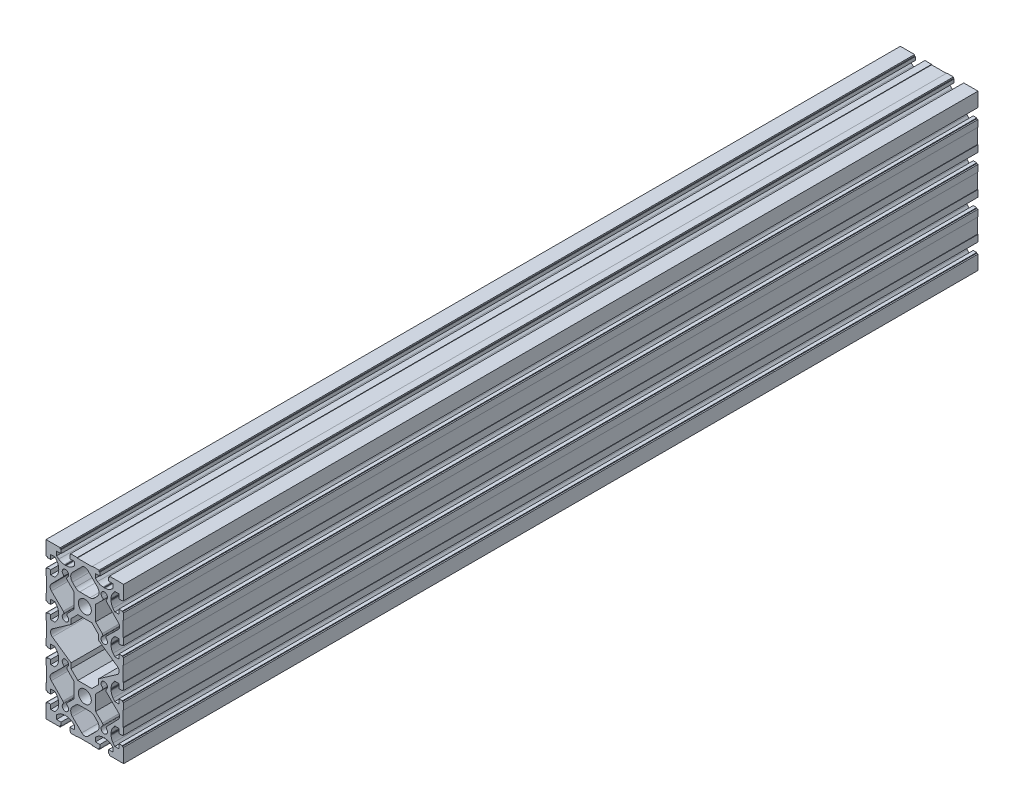
from build123d import *

# Parameters (mm, degrees)
SKETCH5_R           = 7.5
BOSS_EXTRUDE1_DEPTH = 990


with BuildPart() as part:
    # Sketch5 → Boss-Extrude1 (new body)
    with BuildSketch(Plane.XY.offset(10)):
        with BuildLine():
            Line((-45, 36.25), (-45, 28.5))
            Line((-45, 28.5), (-43.5, 28.5))
            Line((-43.5, 28.5), (-43.5, 27.6))
            Line((-43.5, 27.6), (-39.5, 27.6))
            Line((-39.5, 27.6), (-39.5, 32.75))
            Line((-39.5, 32.75), (-34.729898987, 32.75))
            Line((-34.729898987, 32.75), (-32.712991588, 30.246686356))
            ThreePointArc((-32.712991588, 30.246686356), (-31.06946226, 27.299135414), (-30.5, 23.972732261))
            Line((-30.5, 23.972732261), (-30.5, 23))
            Line((-30.5, 23), (-30, 22.5))
            Line((-30, 22.5), (-30.5, 22))
            Line((-30.5, 22), (-30.5, 21.027267739))
            ThreePointArc((-30.5, 21.027267739), (-31.06946226, 17.700864586), (-32.712991588, 14.753313644))
            Line((-32.712991588, 14.753313644), (-34.729898987, 12.25))
            Line((-34.729898987, 12.25), (-39.5, 12.25))
            Line((-39.5, 12.25), (-39.5, 17.4))
            Line((-39.5, 17.4), (-43.5, 17.4))
            Line((-43.5, 17.4), (-43.5, 16.5))
            Line((-43.5, 16.5), (-45, 16.5))
            Line((-45, 16.5), (-45, 8.75))
            Line((-45, 8.75), (-44.5, 8.75))
            Line((-44.5, 8.75), (-44.5, -8.75))
            Line((-44.5, -8.75), (-45, -8.75))
            Line((-45, -8.75), (-45, -16.5))
            Line((-45, -16.5), (-43.5, -16.5))
            Line((-43.5, -16.5), (-43.5, -17.4))
            Line((-43.5, -17.4), (-39.5, -17.4))
            Line((-39.5, -17.4), (-39.5, -12.25))
            Line((-39.5, -12.25), (-34.729898987, -12.25))
            Line((-34.729898987, -12.25), (-32.712991588, -14.753313644))
            ThreePointArc((-32.712991588, -14.753313644), (-31.06946226, -17.700864586), (-30.5, -21.027267739))
            Line((-30.5, -21.027267739), (-30.5, -22))
            Line((-30.5, -22), (-30, -22.5))
            Line((-30, -22.5), (-30.5, -23))
            Line((-30.5, -23), (-30.5, -23.972732261))
            ThreePointArc((-30.5, -23.972732261), (-31.06946226, -27.299135414), (-32.712991588, -30.246686356))
            Line((-32.712991588, -30.246686356), (-34.729898987, -32.75))
            Line((-34.729898987, -32.75), (-39.5, -32.75))
            Line((-39.5, -32.75), (-39.5, -27.6))
            Line((-39.5, -27.6), (-43.5, -27.6))
            Line((-43.5, -27.6), (-43.5, -28.5))
            Line((-43.5, -28.5), (-45, -28.5))
            Line((-45, -28.5), (-45, -36.25))
            Line((-45, -36.25), (-44.5, -36.25))
            Line((-44.5, -36.25), (-44.5, -53.75))
            Line((-44.5, -53.75), (-45, -53.75))
            Line((-45, -53.75), (-45, -61.5))
            Line((-45, -61.5), (-43.5, -61.5))
            Line((-43.5, -61.5), (-43.5, -62.4))
            Line((-43.5, -62.4), (-39.5, -62.4))
            Line((-39.5, -62.4), (-39.5, -57.25))
            Line((-39.5, -57.25), (-34.729898987, -57.25))
            Line((-34.729898987, -57.25), (-32.712991588, -59.753313644))
            ThreePointArc((-32.712991588, -59.753313644), (-31.06946226, -62.700864586), (-30.5, -66.027267739))
            Line((-30.5, -66.027267739), (-30.5, -67))
            Line((-30.5, -67), (-30, -67.5))
            Line((-30, -67.5), (-30.5, -68))
            Line((-30.5, -68), (-30.5, -68.972732261))
            ThreePointArc((-30.5, -68.972732261), (-31.06946226, -72.299135414), (-32.712991588, -75.246686356))
            Line((-32.712991588, -75.246686356), (-34.729898987, -77.75))
            Line((-34.729898987, -77.75), (-39.5, -77.75))
            Line((-39.5, -77.75), (-39.5, -72.6))
            Line((-39.5, -72.6), (-43.5, -72.6))
            Line((-43.5, -72.6), (-43.5, -73.5))
            Line((-43.5, -73.5), (-45, -73.5))
            Line((-45, -73.5), (-45, -90))
            Line((-45, -90), (-28.5, -90))
            Line((-28.5, -90), (-28.5, -88.5))
            Line((-28.5, -88.5), (-27.6, -88.5))
            Line((-27.6, -88.5), (-27.6, -84.5))
            Line((-27.6, -84.5), (-32.75, -84.5))
            Line((-32.75, -84.5), (-32.75, -79.729898987))
            Line((-32.75, -79.729898987), (-30.246686356, -77.712991588))
            ThreePointArc((-30.246686356, -77.712991588), (-27.299135414, -76.06946226), (-23.972732261, -75.5))
            Line((-23.972732261, -75.5), (-23, -75.5))
            Line((-23, -75.5), (-22.5, -75))
            Line((-22.5, -75), (-22, -75.5))
            Line((-22, -75.5), (-21.027267739, -75.5))
            ThreePointArc((-21.027267739, -75.5), (-17.700864586, -76.06946226), (-14.753313644, -77.712991588))
            Line((-14.753313644, -77.712991588), (-12.25, -79.729898987))
            Line((-12.25, -79.729898987), (-12.25, -84.5))
            Line((-12.25, -84.5), (-17.4, -84.5))
            Line((-17.4, -84.5), (-17.4, -88.5))
            Line((-17.4, -88.5), (-16.5, -88.5))
            Line((-16.5, -88.5), (-16.5, -90))
            Line((-16.5, -90), (-8.75, -90))
            Line((-8.75, -90), (-8.75, -89.5))
            Line((-8.75, -89.5), (8.75, -89.5))
            Line((8.75, -89.5), (8.75, -90))
            Line((8.75, -90), (16.5, -90))
            Line((16.5, -90), (16.5, -88.5))
            Line((16.5, -88.5), (17.4, -88.5))
            Line((17.4, -88.5), (17.4, -84.5))
            Line((17.4, -84.5), (12.25, -84.5))
            Line((12.25, -84.5), (12.25, -79.729898987))
            Line((12.25, -79.729898987), (14.753313644, -77.712991588))
            ThreePointArc((14.753313644, -77.712991588), (17.700864586, -76.06946226), (21.027267739, -75.5))
            Line((21.027267739, -75.5), (22, -75.5))
            Line((22, -75.5), (22.5, -75))
            Line((22.5, -75), (23, -75.5))
            Line((23, -75.5), (23.972732261, -75.5))
            ThreePointArc((23.972732261, -75.5), (27.299135414, -76.06946226), (30.246686356, -77.712991588))
            Line((30.246686356, -77.712991588), (32.75, -79.729898987))
            Line((32.75, -79.729898987), (32.75, -84.5))
            Line((32.75, -84.5), (27.6, -84.5))
            Line((27.6, -84.5), (27.6, -88.5))
            Line((27.6, -88.5), (28.5, -88.5))
            Line((28.5, -88.5), (28.5, -90))
            Line((28.5, -90), (45, -90))
            Line((45, -90), (45, -73.5))
            Line((45, -73.5), (43.5, -73.5))
            Line((43.5, -73.5), (43.5, -72.6))
            Line((43.5, -72.6), (39.5, -72.6))
            Line((39.5, -72.6), (39.5, -77.75))
            Line((39.5, -77.75), (34.729898987, -77.75))
            Line((34.729898987, -77.75), (32.712991588, -75.246686356))
            ThreePointArc((32.712991588, -75.246686356), (31.06946226, -72.299135414), (30.5, -68.972732261))
            Line((30.5, -68.972732261), (30.5, -68))
            Line((30.5, -68), (30, -67.5))
            Line((30, -67.5), (30.5, -67))
            Line((30.5, -67), (30.5, -66.027267739))
            ThreePointArc((30.5, -66.027267739), (31.06946226, -62.700864586), (32.712991588, -59.753313644))
            Line((32.712991588, -59.753313644), (34.729898987, -57.25))
            Line((34.729898987, -57.25), (39.5, -57.25))
            Line((39.5, -57.25), (39.5, -62.4))
            Line((39.5, -62.4), (43.5, -62.4))
            Line((43.5, -62.4), (43.5, -61.5))
            Line((43.5, -61.5), (45, -61.5))
            Line((45, -61.5), (45, -53.75))
            Line((45, -53.75), (44.5, -53.75))
            Line((44.5, -53.75), (44.5, -36.25))
            Line((44.5, -36.25), (45, -36.25))
            Line((45, -36.25), (45, -28.5))
            Line((45, -28.5), (43.5, -28.5))
            Line((43.5, -28.5), (43.5, -27.6))
            Line((43.5, -27.6), (39.5, -27.6))
            Line((39.5, -27.6), (39.5, -32.75))
            Line((39.5, -32.75), (34.729898987, -32.75))
            Line((34.729898987, -32.75), (32.712991588, -30.246686356))
            ThreePointArc((32.712991588, -30.246686356), (31.06946226, -27.299135414), (30.5, -23.972732261))
            Line((30.5, -23.972732261), (30.5, -23))
            Line((30.5, -23), (30, -22.5))
            Line((30, -22.5), (30.5, -22))
            Line((30.5, -22), (30.5, -21.027267739))
            ThreePointArc((30.5, -21.027267739), (31.06946226, -17.700864586), (32.712991588, -14.753313644))
            Line((32.712991588, -14.753313644), (34.729898987, -12.25))
            Line((34.729898987, -12.25), (39.5, -12.25))
            Line((39.5, -12.25), (39.5, -17.4))
            Line((39.5, -17.4), (43.5, -17.4))
            Line((43.5, -17.4), (43.5, -16.5))
            Line((43.5, -16.5), (45, -16.5))
            Line((45, -16.5), (45, -8.75))
            Line((45, -8.75), (44.5, -8.75))
            Line((44.5, -8.75), (44.5, 8.75))
            Line((44.5, 8.75), (45, 8.75))
            Line((45, 8.75), (45, 16.5))
            Line((45, 16.5), (43.5, 16.5))
            Line((43.5, 16.5), (43.5, 17.4))
            Line((43.5, 17.4), (39.5, 17.4))
            Line((39.5, 17.4), (39.5, 12.25))
            Line((39.5, 12.25), (34.729898987, 12.25))
            Line((34.729898987, 12.25), (32.712991588, 14.753313644))
            ThreePointArc((32.712991588, 14.753313644), (31.06946226, 17.700864586), (30.5, 21.027267739))
            Line((30.5, 21.027267739), (30.5, 22))
            Line((30.5, 22), (30, 22.5))
            Line((30, 22.5), (30.5, 23))
            Line((30.5, 23), (30.5, 23.972732261))
            ThreePointArc((30.5, 23.972732261), (31.06946226, 27.299135414), (32.712991588, 30.246686356))
            Line((32.712991588, 30.246686356), (34.729898987, 32.75))
            Line((34.729898987, 32.75), (39.5, 32.75))
            Line((39.5, 32.75), (39.5, 27.6))
            Line((39.5, 27.6), (43.5, 27.6))
            Line((43.5, 27.6), (43.5, 28.5))
            Line((43.5, 28.5), (45, 28.5))
            Line((45, 28.5), (45, 36.25))
            Line((45, 36.25), (44.5, 36.25))
            Line((44.5, 36.25), (44.5, 53.75))
            Line((44.5, 53.75), (45, 53.75))
            Line((45, 53.75), (45, 61.5))
            Line((45, 61.5), (43.5, 61.5))
            Line((43.5, 61.5), (43.5, 62.4))
            Line((43.5, 62.4), (39.5, 62.4))
            Line((39.5, 62.4), (39.5, 57.25))
            Line((39.5, 57.25), (34.729898987, 57.25))
            Line((34.729898987, 57.25), (32.712991588, 59.753313644))
            ThreePointArc((32.712991588, 59.753313644), (31.06946226, 62.700864586), (30.5, 66.027267739))
            Line((30.5, 66.027267739), (30.5, 67))
            Line((30.5, 67), (30, 67.5))
            Line((30, 67.5), (30.5, 68))
            Line((30.5, 68), (30.5, 68.972732261))
            ThreePointArc((30.5, 68.972732261), (31.06946226, 72.299135414), (32.712991588, 75.246686356))
            Line((32.712991588, 75.246686356), (34.729898987, 77.75))
            Line((34.729898987, 77.75), (39.5, 77.75))
            Line((39.5, 77.75), (39.5, 72.6))
            Line((39.5, 72.6), (43.5, 72.6))
            Line((43.5, 72.6), (43.5, 73.5))
            Line((43.5, 73.5), (45, 73.5))
            Line((45, 73.5), (45, 90))
            Line((45, 90), (28.5, 90))
            Line((28.5, 90), (28.5, 88.5))
            Line((28.5, 88.5), (27.6, 88.5))
            Line((27.6, 88.5), (27.6, 84.5))
            Line((27.6, 84.5), (32.75, 84.5))
            Line((32.75, 84.5), (32.75, 79.729898987))
            Line((32.75, 79.729898987), (30.246686356, 77.712991588))
            ThreePointArc((30.246686356, 77.712991588), (27.299135414, 76.06946226), (23.972732261, 75.5))
            Line((23.972732261, 75.5), (23, 75.5))
            Line((23, 75.5), (22.5, 75))
            Line((22.5, 75), (22, 75.5))
            Line((22, 75.5), (21.027267739, 75.5))
            ThreePointArc((21.027267739, 75.5), (17.700864586, 76.06946226), (14.753313644, 77.712991588))
            Line((14.753313644, 77.712991588), (12.25, 79.729898987))
            Line((12.25, 79.729898987), (12.25, 84.5))
            Line((12.25, 84.5), (17.4, 84.5))
            Line((17.4, 84.5), (17.4, 88.5))
            Line((17.4, 88.5), (16.5, 88.5))
            Line((16.5, 88.5), (16.5, 90))
            Line((16.5, 90), (8.75, 90))
            Line((8.75, 90), (8.75, 89.5))
            Line((8.75, 89.5), (-8.75, 89.5))
            Line((-8.75, 89.5), (-8.75, 90))
            Line((-8.75, 90), (-16.5, 90))
            Line((-16.5, 90), (-16.5, 88.5))
            Line((-16.5, 88.5), (-17.4, 88.5))
            Line((-17.4, 88.5), (-17.4, 84.5))
            Line((-17.4, 84.5), (-12.25, 84.5))
            Line((-12.25, 84.5), (-12.25, 79.729898987))
            Line((-12.25, 79.729898987), (-14.753313644, 77.712991588))
            ThreePointArc((-14.753313644, 77.712991588), (-17.700864586, 76.06946226), (-21.027267739, 75.5))
            Line((-21.027267739, 75.5), (-22, 75.5))
            Line((-22, 75.5), (-22.5, 75))
            Line((-22.5, 75), (-23, 75.5))
            Line((-23, 75.5), (-23.972732261, 75.5))
            ThreePointArc((-23.972732261, 75.5), (-27.299135414, 76.06946226), (-30.246686356, 77.712991588))
            Line((-30.246686356, 77.712991588), (-32.75, 79.729898987))
            Line((-32.75, 79.729898987), (-32.75, 84.5))
            Line((-32.75, 84.5), (-27.6, 84.5))
            Line((-27.6, 84.5), (-27.6, 88.5))
            Line((-27.6, 88.5), (-28.5, 88.5))
            Line((-28.5, 88.5), (-28.5, 90))
            Line((-28.5, 90), (-45, 90))
            Line((-45, 90), (-45, 73.5))
            Line((-45, 73.5), (-43.5, 73.5))
            Line((-43.5, 73.5), (-43.5, 72.6))
            Line((-43.5, 72.6), (-39.5, 72.6))
            Line((-39.5, 72.6), (-39.5, 77.75))
            Line((-39.5, 77.75), (-34.729898987, 77.75))
            Line((-34.729898987, 77.75), (-32.712991588, 75.246686356))
            ThreePointArc((-32.712991588, 75.246686356), (-31.06946226, 72.299135414), (-30.5, 68.972732261))
            Line((-30.5, 68.972732261), (-30.5, 68))
            Line((-30.5, 68), (-30, 67.5))
            Line((-30, 67.5), (-30.5, 67))
            Line((-30.5, 67), (-30.5, 66.027267739))
            ThreePointArc((-30.5, 66.027267739), (-31.06946226, 62.700864586), (-32.712991588, 59.753313644))
            Line((-32.712991588, 59.753313644), (-34.729898987, 57.25))
            Line((-34.729898987, 57.25), (-39.5, 57.25))
            Line((-39.5, 57.25), (-39.5, 62.4))
            Line((-39.5, 62.4), (-43.5, 62.4))
            Line((-43.5, 62.4), (-43.5, 61.5))
            Line((-43.5, 61.5), (-45, 61.5))
            Line((-45, 61.5), (-45, 53.75))
            Line((-45, 53.75), (-44.5, 53.75))
            Line((-44.5, 53.75), (-44.5, 36.25))
            Line((-44.5, 36.25), (-45, 36.25))
        make_face()
        with Locations((0, 45.086880858)):
            Circle(SKETCH5_R, mode=Mode.SUBTRACT)
        with Locations((0, -45.086880858)):
            Circle(SKETCH5_R, mode=Mode.SUBTRACT)
        with BuildLine():
            Line((-14.35107998, 62.566463458), (-10.85982128, 59.063435043))
            ThreePointArc((-10.85982128, 59.063435043), (-8.589599626, 57.542373557), (-5.909652822, 57.008126862))
            Line((-5.909652822, 57.008126862), (5.909652822, 57.008126862))
            ThreePointArc((5.909652822, 57.008126862), (8.589599626, 57.542373557), (10.85982128, 59.063435043))
            Line((10.85982128, 59.063435043), (14.35107998, 62.566463458))
            ThreePointArc((14.35107998, 62.566463458), (16.389756246, 67.5), (14.35107998, 72.433536542))
            Line((14.35107998, 72.433536542), (3.541478351, 83.279579449))
            ThreePointArc((3.541478351, 83.279579449), (0, 84.75), (-3.541478351, 83.279579449))
            Line((-3.541478351, 83.279579449), (-14.35107998, 72.433536542))
            ThreePointArc((-14.35107998, 72.433536542), (-16.389756246, 67.5), (-14.35107998, 62.566463458))
        make_face(mode=Mode.SUBTRACT)
        with BuildLine():
            Line((5.909652822, -57.008126862), (-5.909652822, -57.008126862))
            ThreePointArc((-5.909652822, -57.008126862), (-8.589599626, -57.542373557), (-10.85982128, -59.063435043))
            Line((-10.85982128, -59.063435043), (-14.35107998, -62.566463458))
            ThreePointArc((-14.35107998, -62.566463458), (-16.389756246, -67.5), (-14.35107998, -72.433536542))
            Line((-14.35107998, -72.433536542), (-3.541478351, -83.279579449))
            ThreePointArc((-3.541478351, -83.279579449), (0, -84.75), (3.541478351, -83.279579449))
            Line((3.541478351, -83.279579449), (14.35107998, -72.433536542))
            ThreePointArc((14.35107998, -72.433536542), (16.389756246, -67.5), (14.35107998, -62.566463458))
            Line((14.35107998, -62.566463458), (10.85982128, -59.063435043))
            ThreePointArc((10.85982128, -59.063435043), (8.589599626, -57.542373557), (5.909652822, -57.008126862))
        make_face(mode=Mode.SUBTRACT)
        with BuildLine():
            Line((-16, -25.11), (-8.11, -33))
            Line((-8.11, -33), (8.11, -33))
            Line((8.11, -33), (16, -25.11))
            Line((16, -25.11), (16, -19.23))
            Line((16, -19.23), (37.611740325, -4.095610054))
            ThreePointArc((37.611740325, -4.095610054), (39.743643694, 0), (37.611740325, 4.095610054))
            Line((37.611740325, 4.095610054), (16, 19.23))
            Line((16, 19.23), (16, 25.11))
            Line((16, 25.11), (8.11, 33))
            Line((8.11, 33), (-8.11, 33))
            Line((-8.11, 33), (-16, 25.11))
            Line((-16, 25.11), (-16, 19.23))
            Line((-16, 19.23), (-37.611740325, 4.095610054))
            ThreePointArc((-37.611740325, 4.095610054), (-39.743643694, 0), (-37.611740325, -4.095610054))
            Line((-37.611740325, -4.095610054), (-16, -19.23))
            Line((-16, -19.23), (-16, -25.11))
        make_face(mode=Mode.SUBTRACT)
        with BuildLine():
            Line((38.816173405, 48.578707453), (25.368550039, 62.360923911))
            ThreePointArc((25.368550039, 62.360923911), (24.800843667, 63.700716577), (25.291375648, 65.070648432))
            ThreePointArc((25.291375648, 65.070648432), (22.133313929, 71.182264029), (20.242529167, 64.567875772))
            ThreePointArc((20.242529167, 64.567875772), (21.01901119, 63.100070212), (20.419162461, 61.551664905))
            Line((20.419162461, 61.551664905), (12.49, 53.815))
            Line((12.49, 53.815), (12.49, 36.185))
            Line((12.49, 36.185), (20.240887882, 28.241260677))
            ThreePointArc((20.240887882, 28.241260677), (20.807220079, 26.751071402), (20.104242284, 25.320260984))
            ThreePointArc((20.104242284, 25.320260984), (22.415005086, 18.80049964), (25.02275085, 25.207259722))
            ThreePointArc((25.02275085, 25.207259722), (24.386356314, 26.647478257), (24.989493691, 28.101937862))
            Line((24.989493691, 28.101937862), (38.729292547, 41.508173405))
            ThreePointArc((38.729292547, 41.508173405), (40.237088524, 45.025446814), (38.816173405, 48.578707453))
        make_face(mode=Mode.SUBTRACT)
        with BuildLine():
            Line((-12.49, 53.815), (-20.419162461, 61.551664905))
            ThreePointArc((-20.419162461, 61.551664905), (-21.01901119, 63.100070212), (-20.242529167, 64.567875772))
            ThreePointArc((-20.242529167, 64.567875772), (-22.133313929, 71.182264029), (-25.291375648, 65.070648432))
            ThreePointArc((-25.291375648, 65.070648432), (-24.800843667, 63.700716577), (-25.368550039, 62.360923911))
            Line((-25.368550039, 62.360923911), (-38.816173405, 48.578707453))
            ThreePointArc((-38.816173405, 48.578707453), (-40.237088524, 45.025446814), (-38.729292547, 41.508173405))
            Line((-38.729292547, 41.508173405), (-24.989493691, 28.101937862))
            ThreePointArc((-24.989493691, 28.101937862), (-24.386356314, 26.647478257), (-25.02275085, 25.207259722))
            ThreePointArc((-25.02275085, 25.207259722), (-22.415005086, 18.80049964), (-20.104242284, 25.320260984))
            ThreePointArc((-20.104242284, 25.320260984), (-20.807220079, 26.751071402), (-20.240887882, 28.241260677))
            Line((-20.240887882, 28.241260677), (-12.49, 36.185))
            Line((-12.49, 36.185), (-12.49, 53.815))
        make_face(mode=Mode.SUBTRACT)
        with BuildLine():
            Line((12.49, -53.815), (20.419162461, -61.551664905))
            ThreePointArc((20.419162461, -61.551664905), (21.01901119, -63.100070212), (20.242529167, -64.567875772))
            ThreePointArc((20.242529167, -64.567875772), (22.133313929, -71.182264029), (25.291375648, -65.070648432))
            ThreePointArc((25.291375648, -65.070648432), (24.800843667, -63.700716577), (25.368550039, -62.360923911))
            Line((25.368550039, -62.360923911), (38.816173405, -48.578707453))
            ThreePointArc((38.816173405, -48.578707453), (40.237088524, -45.025446814), (38.729292547, -41.508173405))
            Line((38.729292547, -41.508173405), (24.989493691, -28.101937862))
            ThreePointArc((24.989493691, -28.101937862), (24.386356314, -26.647478257), (25.02275085, -25.207259722))
            ThreePointArc((25.02275085, -25.207259722), (22.415005086, -18.80049964), (20.104242284, -25.320260984))
            ThreePointArc((20.104242284, -25.320260984), (20.807220079, -26.751071402), (20.240887882, -28.241260677))
            Line((20.240887882, -28.241260677), (12.49, -36.185))
            Line((12.49, -36.185), (12.49, -53.815))
        make_face(mode=Mode.SUBTRACT)
        with BuildLine():
            Line((-38.816173405, -48.578707453), (-25.368550039, -62.360923911))
            ThreePointArc((-25.368550039, -62.360923911), (-24.800843667, -63.700716577), (-25.291375648, -65.070648432))
            ThreePointArc((-25.291375648, -65.070648432), (-22.133313929, -71.182264029), (-20.242529167, -64.567875772))
            ThreePointArc((-20.242529167, -64.567875772), (-21.01901119, -63.100070212), (-20.419162461, -61.551664905))
            Line((-20.419162461, -61.551664905), (-12.49, -53.815))
            Line((-12.49, -53.815), (-12.49, -36.185))
            Line((-12.49, -36.185), (-20.240887882, -28.241260677))
            ThreePointArc((-20.240887882, -28.241260677), (-20.807220079, -26.751071402), (-20.104242284, -25.320260984))
            ThreePointArc((-20.104242284, -25.320260984), (-22.415005086, -18.80049964), (-25.02275085, -25.207259722))
            ThreePointArc((-25.02275085, -25.207259722), (-24.386356314, -26.647478257), (-24.989493691, -28.101937862))
            Line((-24.989493691, -28.101937862), (-38.729292547, -41.508173405))
            ThreePointArc((-38.729292547, -41.508173405), (-40.237088524, -45.025446814), (-38.816173405, -48.578707453))
        make_face(mode=Mode.SUBTRACT)
    extrude(amount=BOSS_EXTRUDE1_DEPTH)


solid = part.part
